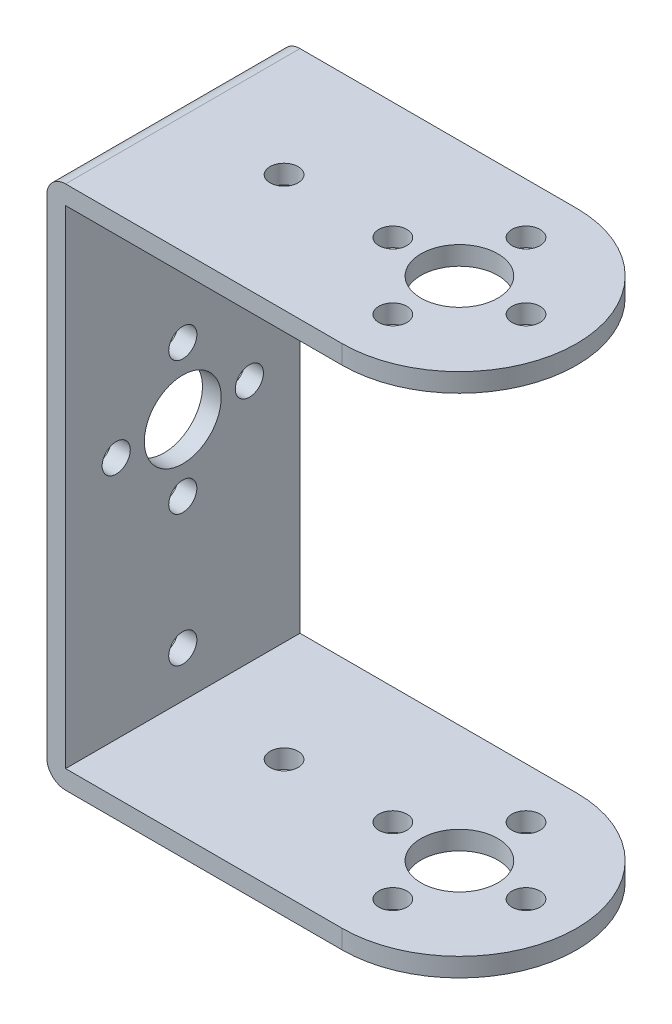
from build123d import *

# Parameters (mm, degrees)
SKETCH_1_W          = 44
SKETCH_1_H          = 25
EXTRUDE_1_DEPTH     = 2
SKETCH_2_W          = 2
SKETCH_2_H          = 25
EXTRUDE_2_DEPTH     = 56
FILLET_1_RADIUS     = 12.5
FILLET_1_LENGTH     = 2
CUT_EXTRUDE_2_REACH = 63.451
SKETCH_3_R          = 4.1
SKETCH_3_R_2        = 1.5
CUT_EXTRUDE_3_REACH = 74.307
SKETCH_4_R          = 4.1
SKETCH_4_R_2        = 1.5
FILLET_2_R          = 2


with BuildPart() as part:
    # 草图1 → 凸台-拉伸1 (new body)
    with BuildSketch(Plane(origin=(0, 0, 0), x_dir=(1, 0, 0), z_dir=(0, 1, 0))):
        Rectangle(SKETCH_1_W, SKETCH_1_H)
    extrude(amount=-EXTRUDE_1_DEPTH)

    # 草图2 → 凸台-拉伸2 (add)
    with BuildSketch(Plane(origin=(0, 0, 0), x_dir=(1, 0, 0), z_dir=(0, 1, 0))):
        with Locations((-21, 0)):
            Rectangle(SKETCH_2_W, SKETCH_2_H)
    extrude(amount=-EXTRUDE_2_DEPTH)

    # 圆角1: full round fillet: the end face becomes a half cylinder, R = half its width
    fillet_1_face = Plane((22, -1, 0), x_dir=(0, 1, 0), z_dir=(1, 0, 0))  # on the end face: x along it, z out of the body
    fillet_1_slab = fillet_1_face.offset(-FILLET_1_RADIUS / 2) * Box(FILLET_1_LENGTH, 2 * FILLET_1_RADIUS, FILLET_1_RADIUS, mode=Mode.PRIVATE)  # the body's end, R deep
    fillet_1_round = Plane((9.5, -1, 0), x_dir=(1, 0, 0), z_dir=(0, 1, 0)) * Cylinder(FILLET_1_RADIUS, FILLET_1_LENGTH, mode=Mode.PRIVATE)  # its axis R under the face
    add(fillet_1_slab - fillet_1_round, mode=Mode.SUBTRACT)

    # 草图3 → 切除-拉伸2 (cut, up to next)
    with BuildSketch(Plane(origin=(0, 0, 0), x_dir=(1, 0, 0), z_dir=(0, 1, 0)), mode=Mode.PRIVATE) as cut_extrude_2_sk1:
        with Locations(Location((9.5, 0, 0), (0, 0, 270))):
            Circle(SKETCH_3_R)
    cut_extrude_2_tool1 = extrude(cut_extrude_2_sk1.sketch, amount=-CUT_EXTRUDE_2_REACH, mode=Mode.PRIVATE) & part.part
    # 草图3 → 切除-拉伸2 (cut, up to next)
    with BuildSketch(Plane(origin=(0, 0, 0), x_dir=(1, 0, 0), z_dir=(0, 1, 0)), mode=Mode.PRIVATE) as cut_extrude_2_sk2:
        with Locations(Location((2.4, 0, 0), (0, 0, 270))):
            Circle(SKETCH_3_R_2)
    cut_extrude_2_tool2 = extrude(cut_extrude_2_sk2.sketch, amount=-CUT_EXTRUDE_2_REACH, mode=Mode.PRIVATE) & part.part
    # 草图3 → 切除-拉伸2 (cut, up to next)
    with BuildSketch(Plane(origin=(0, 0, 0), x_dir=(1, 0, 0), z_dir=(0, 1, 0)), mode=Mode.PRIVATE) as cut_extrude_2_sk3:
        with Locations(Location((9.5, 7.1, 0), (0, 0, 270))):
            Circle(SKETCH_3_R_2)
    cut_extrude_2_tool3 = extrude(cut_extrude_2_sk3.sketch, amount=-CUT_EXTRUDE_2_REACH, mode=Mode.PRIVATE) & part.part
    # 草图3 → 切除-拉伸2 (cut, up to next)
    with BuildSketch(Plane(origin=(0, 0, 0), x_dir=(1, 0, 0), z_dir=(0, 1, 0)), mode=Mode.PRIVATE) as cut_extrude_2_sk4:
        with Locations(Location((16.6, 0, 0), (0, 0, 270))):
            Circle(SKETCH_3_R_2)
    cut_extrude_2_tool4 = extrude(cut_extrude_2_sk4.sketch, amount=-CUT_EXTRUDE_2_REACH, mode=Mode.PRIVATE) & part.part
    # 草图3 → 切除-拉伸2 (cut, up to next)
    with BuildSketch(Plane(origin=(0, 0, 0), x_dir=(1, 0, 0), z_dir=(0, 1, 0)), mode=Mode.PRIVATE) as cut_extrude_2_sk5:
        with Locations(Location((9.5, -7.1, 0), (0, 0, 270))):
            Circle(SKETCH_3_R_2)
    cut_extrude_2_tool5 = extrude(cut_extrude_2_sk5.sketch, amount=-CUT_EXTRUDE_2_REACH, mode=Mode.PRIVATE) & part.part
    # 草图3 → 切除-拉伸2 (cut, up to next)
    with BuildSketch(Plane(origin=(0, 0, 0), x_dir=(1, 0, 0), z_dir=(0, 1, 0)), mode=Mode.PRIVATE) as cut_extrude_2_sk6:
        with Locations(Location((-9.2, 0, 0), (0, 0, 270))):
            Circle(SKETCH_3_R_2)
    cut_extrude_2_tool6 = extrude(cut_extrude_2_sk6.sketch, amount=-CUT_EXTRUDE_2_REACH, mode=Mode.PRIVATE) & part.part
    add(cut_extrude_2_tool1.solids().sort_by_distance((9.5, 0, 0))[0], mode=Mode.SUBTRACT)
    add(cut_extrude_2_tool2.solids().sort_by_distance((2.4, 0, 0))[0], mode=Mode.SUBTRACT)
    add(cut_extrude_2_tool3.solids().sort_by_distance((9.5, 0, -7.1))[0], mode=Mode.SUBTRACT)
    add(cut_extrude_2_tool4.solids().sort_by_distance((16.6, 0, 0))[0], mode=Mode.SUBTRACT)
    add(cut_extrude_2_tool5.solids().sort_by_distance((9.5, 0, 7.1))[0], mode=Mode.SUBTRACT)
    add(cut_extrude_2_tool6.solids().sort_by_distance((-9.2, 0, 0))[0], mode=Mode.SUBTRACT)

    # 镜向2: part across plane


with BuildPart() as part_1:
    add(part.part)
    add(part.part.mirror(Plane.ZX.offset(-28)))

    # 草图4 → 切除-拉伸3 (cut, up to next)
    with BuildSketch(Plane.ZY.offset(22), mode=Mode.PRIVATE) as cut_extrude_3_sk1:
        with Locations((0, -28)):
            Circle(SKETCH_4_R)
    cut_extrude_3_tool1 = extrude(cut_extrude_3_sk1.sketch, amount=-CUT_EXTRUDE_3_REACH, mode=Mode.PRIVATE) & part_1.part
    # 草图4 → 切除-拉伸3 (cut, up to next)
    with BuildSketch(Plane.ZY.offset(22), mode=Mode.PRIVATE) as cut_extrude_3_sk2:
        with Locations((0, -20.9)):
            Circle(SKETCH_4_R_2)
    cut_extrude_3_tool2 = extrude(cut_extrude_3_sk2.sketch, amount=-CUT_EXTRUDE_3_REACH, mode=Mode.PRIVATE) & part_1.part
    # 草图4 → 切除-拉伸3 (cut, up to next)
    with BuildSketch(Plane.ZY.offset(22), mode=Mode.PRIVATE) as cut_extrude_3_sk3:
        with Locations((7.1, -28)):
            Circle(SKETCH_4_R_2)
    cut_extrude_3_tool3 = extrude(cut_extrude_3_sk3.sketch, amount=-CUT_EXTRUDE_3_REACH, mode=Mode.PRIVATE) & part_1.part
    # 草图4 → 切除-拉伸3 (cut, up to next)
    with BuildSketch(Plane.ZY.offset(22), mode=Mode.PRIVATE) as cut_extrude_3_sk4:
        with Locations((0, -35.1)):
            Circle(SKETCH_4_R_2)
    cut_extrude_3_tool4 = extrude(cut_extrude_3_sk4.sketch, amount=-CUT_EXTRUDE_3_REACH, mode=Mode.PRIVATE) & part_1.part
    # 草图4 → 切除-拉伸3 (cut, up to next)
    with BuildSketch(Plane.ZY.offset(22), mode=Mode.PRIVATE) as cut_extrude_3_sk5:
        with Locations((-7.1, -28)):
            Circle(SKETCH_4_R_2)
    cut_extrude_3_tool5 = extrude(cut_extrude_3_sk5.sketch, amount=-CUT_EXTRUDE_3_REACH, mode=Mode.PRIVATE) & part_1.part
    # 草图4 → 切除-拉伸3 (cut, up to next)
    with BuildSketch(Plane.ZY.offset(22), mode=Mode.PRIVATE) as cut_extrude_3_sk6:
        with Locations((0, -6.9)):
            Circle(SKETCH_4_R_2)
    cut_extrude_3_tool6 = extrude(cut_extrude_3_sk6.sketch, amount=-CUT_EXTRUDE_3_REACH, mode=Mode.PRIVATE) & part_1.part
    # 草图4 → 切除-拉伸3 (cut, up to next)
    with BuildSketch(Plane.ZY.offset(22), mode=Mode.PRIVATE) as cut_extrude_3_sk7:
        with Locations(Location((0, -49.1, 0), (0, 0, 180))):
            Circle(SKETCH_4_R_2)
    cut_extrude_3_tool7 = extrude(cut_extrude_3_sk7.sketch, amount=-CUT_EXTRUDE_3_REACH, mode=Mode.PRIVATE) & part_1.part
    add(cut_extrude_3_tool1.solids().sort_by_distance((-22, -28, 0))[0], mode=Mode.SUBTRACT)
    add(cut_extrude_3_tool2.solids().sort_by_distance((-22, -20.9, 0))[0], mode=Mode.SUBTRACT)
    add(cut_extrude_3_tool3.solids().sort_by_distance((-22, -28, 7.1))[0], mode=Mode.SUBTRACT)
    add(cut_extrude_3_tool4.solids().sort_by_distance((-22, -35.1, 0))[0], mode=Mode.SUBTRACT)
    add(cut_extrude_3_tool5.solids().sort_by_distance((-22, -28, -7.1))[0], mode=Mode.SUBTRACT)
    add(cut_extrude_3_tool6.solids().sort_by_distance((-22, -6.9, 0))[0], mode=Mode.SUBTRACT)
    add(cut_extrude_3_tool7.solids().sort_by_distance((-22, -49.1, 0))[0], mode=Mode.SUBTRACT)

    # 圆角2
    fillet_2_edges = [part_1.edges().sort_by_distance(p)[0] for p in [
        (-22, -56, 0),
        (-22, 0, 0),
    ]]
    fillet(fillet_2_edges, radius=FILLET_2_R)


solid = part_1.part
